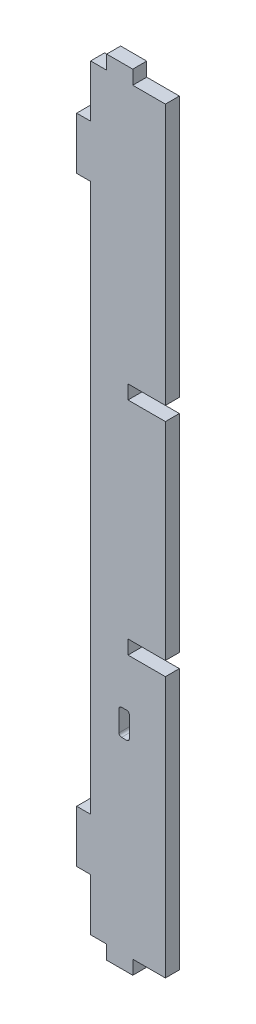
from build123d import *

# Parameters (mm, degrees)
BOSS_EXTRUDE1_DEPTH = 5.35


with BuildPart() as part:
    # Model → Boss-Extrude1 (new body)
    with BuildSketch(Plane.XY):
        Polygon((0, 25.350004435), (5.350001156, 25.350004435), (5.350001156, 5.350008607), (11.500000954, 5.350008607), (11.500000954, 0), (21.50000073, 0), (21.50000073, 5.350008607), (34.000000916, 5.350008607), (34.000000916, 105.350002646), (19.675000687, 105.350002646), (19.675000687, 110.700011253), (34.000000916, 110.700011253), (34.000000916, 190.000005066), (19.675000687, 190.000005066), (19.675000687, 195.350006223), (34.000000916, 195.350006223), (34.000000916, 295.350007713), (21.50000073, 295.350007713), (21.50000073, 300.700008869), (11.500000954, 300.700008869), (11.500000954, 295.350007713), (5.350001156, 295.350007713), (5.350001156, 275.35000816), (0, 275.35000816), (0, 255.350007676), (5.350001156, 255.350007676), (5.350001156, 45.350000262), (0, 45.350000262), align=None)
        with BuildLine():
            Line((20.197596634, 77.811388135), (20.197596634, 85.811391473))
            ThreePointArc((20.197596634, 85.811391473), (19.904704132, 86.518499564), (19.197596634, 86.811393499))
            Line((19.197596634, 86.811393499), (17.197596841, 86.811393499))
            ThreePointArc((17.197596841, 86.811393499), (16.490489953, 86.518500339), (16.197596677, 85.811393499))
            Line((16.197596677, 85.811393499), (16.197596677, 77.811390161))
            ThreePointArc((16.197596677, 77.811390161), (16.490489179, 77.10428207), (17.197596677, 76.811388135))
            Line((17.197596677, 76.811388135), (19.197596703, 76.811388135))
            ThreePointArc((19.197596703, 76.811388135), (19.904703439, 77.104281378), (20.197596634, 77.811388135))
        make_face(mode=Mode.SUBTRACT)
    extrude(amount=BOSS_EXTRUDE1_DEPTH)


solid = part.part
